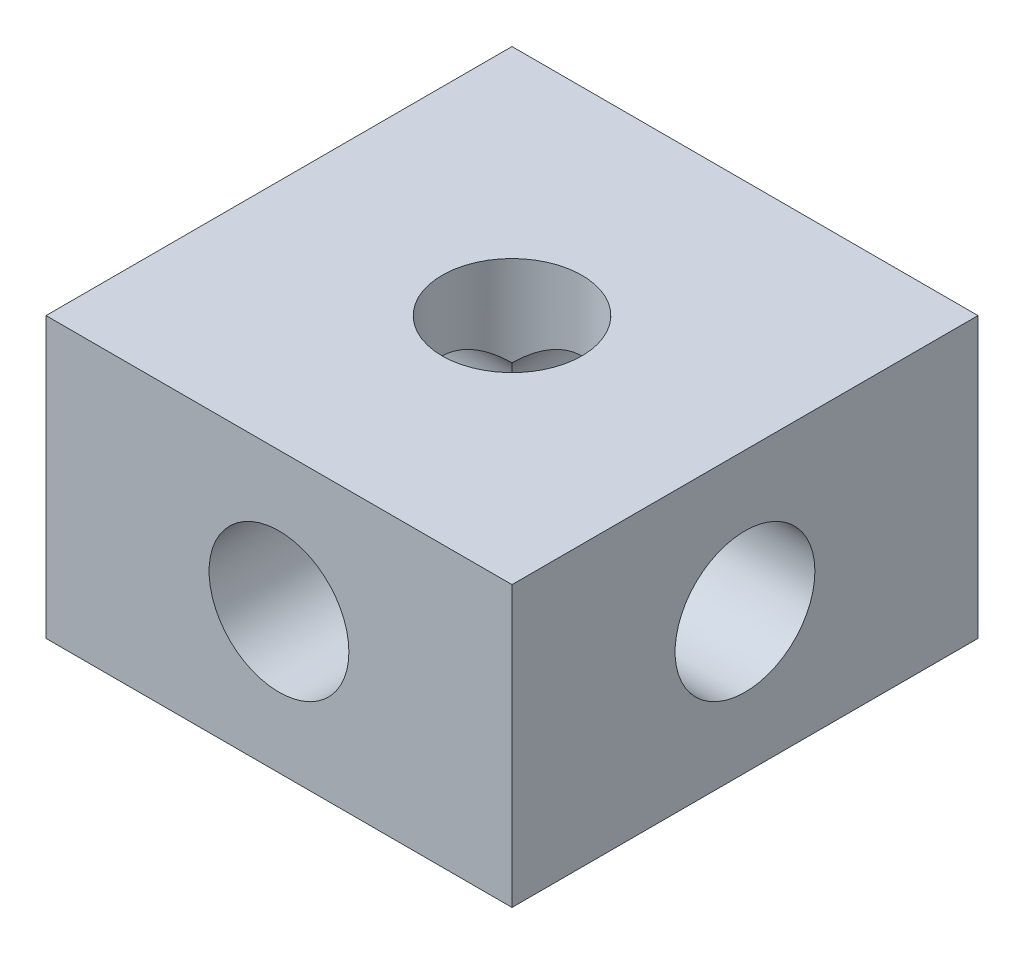
from build123d import *

# Parameters (mm, degrees)
SKETCH_1_W          = 10
SKETCH_1_H          = 10
SKETCH_1_R          = 1.5
EXTRUDE_1_DEPTH     = 3
SKETCH_3_R          = 1.5
CUT_EXTRUDE_1_DEPTH = 11
SKETCH_4_R          = 1.5
CUT_EXTRUDE_2_DEPTH = 11


with BuildPart() as part:
    # 草图1 → 凸台-拉伸1 (new, symmetric)
    with BuildSketch(Plane(origin=(0, 0, 0), x_dir=(1, 0, 0), z_dir=(0, 1, 0))):
        Rectangle(SKETCH_1_W, SKETCH_1_H)
        with Locations(Location((0, 0, 0), (0, 0, 270))):
            Circle(SKETCH_1_R, mode=Mode.SUBTRACT)
    extrude(amount=EXTRUDE_1_DEPTH, both=True)

    # 草图3 → 切除-拉伸1 (cut)
    with BuildSketch(Plane.XY.offset(5)):
        Circle(SKETCH_3_R)
    extrude(amount=-CUT_EXTRUDE_1_DEPTH, mode=Mode.SUBTRACT)

    # 草图4 → 切除-拉伸2 (cut)
    with BuildSketch(Plane(origin=(5, 0, 0), x_dir=(0, 0, -1), z_dir=(1, 0, 0))):
        Circle(SKETCH_4_R)
    extrude(amount=-CUT_EXTRUDE_2_DEPTH, mode=Mode.SUBTRACT)


solid = part.part
